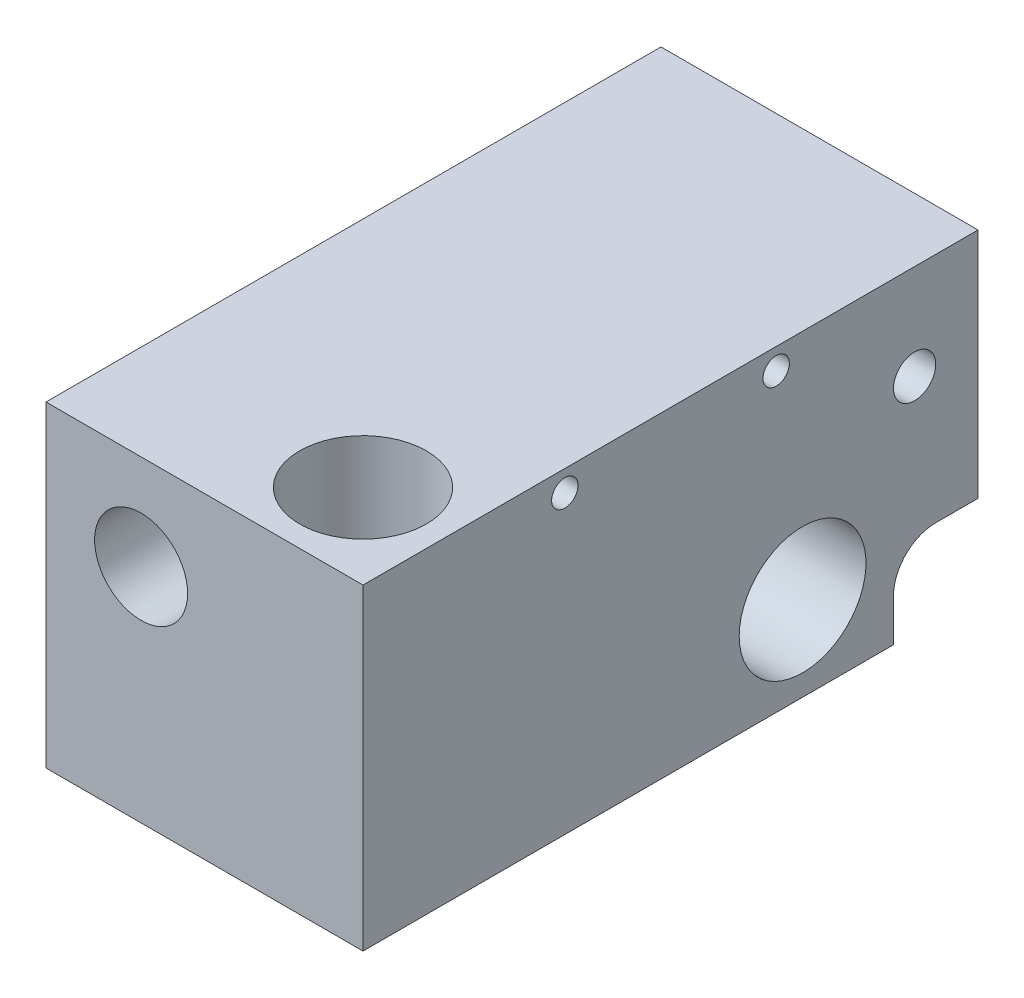
from build123d import *

# Parameters (mm, degrees)
SCHIZZO1_W                   = 30.00001
SCHIZZO1_H                   = 30.00001
ESTRUSIONE_ESTRUSIONE1_DEPTH = 58.2
TAGLIO_ESTRUSIONE1_REACH     = 74.023
SCHIZZO2_R                   = 6
TAGLIO_ESTRUSIONE2_REACH     = 74.023
SCHIZZO3_R                   = 6
SCHIZZO5_R                   = 7
TAGLIO_ESTRUSIONE3_DEPTH     = 20
FORO_6_0_6_1_D               = 6
FORO_FILETTATO_G1_8_1_D      = 8.8
FORO_FILETTATO_G1_8_1_DEPTH  = 10
FORO_FILETTATO_G1_8_1_TIP    = 2.643786724
FORO_FILETTATO_M3_1_REACH    = 74.023
FORO_FILETTATO_M3_1_BORE_R   = 1.25
FORO_4_0_4_2_D               = 4
FORO_4_0_4_2_DEPTH           = 8
FORO_4_0_4_2_TIP             = 1.201721238
TAGLIO_ESTRUSIONE5_DEPTH     = 10
TAGLIO_ESTRUSIONE6_START     = -10
TAGLIO_ESTRUSIONE6_DEPTH     = 10
SCHIZZO23_R                  = 1.6
TAGLIO_ESTRUSIONE7_DEPTH     = 10.00001
ESTRUSIONE_ESTRUSIONE2_START = 7
SCHIZZO24_R                  = 7
SCHIZZO24_R_2                = 3
ESTRUSIONE_ESTRUSIONE2_DEPTH = 7
FORO_FILETTATO_M3_2_D        = 2.5
FORO_FILETTATO_M3_2_DEPTH    = 11.5
FORO_FILETTATO_M3_2_TIP      = 0.751075774


with BuildPart() as part:
    # Schizzo1 → Estrusione-Estrusione1 (new body)
    with BuildSketch(Plane.XY):
        with Locations((15.000005, 15.000005)):
            Rectangle(SCHIZZO1_W, SCHIZZO1_H)
    extrude(amount=ESTRUSIONE_ESTRUSIONE1_DEPTH)

    # Schizzo2 → Taglio-Estrusione1 (cut, up to next)
    with BuildSketch(Plane.XZ, mode=Mode.PRIVATE) as taglio_estrusione1_sk1:
        with Locations(Location((22.00001, 50.2, 0), (0, 0, 270))):
            Circle(SCHIZZO2_R)
    taglio_estrusione1_tool1 = extrude(taglio_estrusione1_sk1.sketch, amount=-TAGLIO_ESTRUSIONE1_REACH, mode=Mode.PRIVATE) & part.part
    add(taglio_estrusione1_tool1.solids().sort_by_distance((22.00001, 0, 50.2))[0], mode=Mode.SUBTRACT)

    # Schizzo3 → Taglio-Estrusione2 (cut, up to next)
    with BuildSketch(Plane.ZY, mode=Mode.PRIVATE) as taglio_estrusione2_sk1:
        with Locations((16.6, 8)):
            Circle(SCHIZZO3_R)
    taglio_estrusione2_tool1 = extrude(taglio_estrusione2_sk1.sketch, amount=-TAGLIO_ESTRUSIONE2_REACH, mode=Mode.PRIVATE) & part.part
    add(taglio_estrusione2_tool1.solids().sort_by_distance((0, 8, 16.6))[0], mode=Mode.SUBTRACT)

    # Schizzo5 → Taglio-Estrusione3 (cut)
    with BuildSketch(Plane(origin=(0, 0, 0), x_dir=(-1, 0, 0), z_dir=(0, 0, -1))):
        with Locations((-9, 21.00001)):
            Circle(SCHIZZO5_R)
    extrude(amount=-TAGLIO_ESTRUSIONE3_DEPTH, mode=Mode.SUBTRACT)

    # Foro Ø6.0 (6)-1 (through all)
    with Locations(Plane.XY.offset(58.2)):
        with Locations((9, 21.00001)):
            Hole(FORO_6_0_6_1_D / 2)

    # Foro filettato G1/8-1
    with Locations(Plane(origin=(9, 21.00001, 58.2), x_dir=(1, 0, 0), z_dir=(0, 0, 1))):
        with Locations((0, 0)):
            Hole(FORO_FILETTATO_G1_8_1_D / 2, depth=FORO_FILETTATO_G1_8_1_DEPTH)
            with Locations((0, 0, -(FORO_FILETTATO_G1_8_1_DEPTH + FORO_FILETTATO_G1_8_1_TIP / 2))):  # 118° drill point
                Cone(0, FORO_FILETTATO_G1_8_1_D / 2, FORO_FILETTATO_G1_8_1_TIP, mode=Mode.SUBTRACT)

    # Foro filettato M3-1 bore → Foro filettato M3-1 (cut, up to next)
    with BuildSketch(Plane(origin=(30.00001, 0, 0), x_dir=(0, 0, -1), z_dir=(1, 0, 0)), mode=Mode.PRIVATE) as foro_filettato_m3_1_sk1:
        with Locations((-6, 21.00001)):
            Circle(FORO_FILETTATO_M3_1_BORE_R)
    foro_filettato_m3_1_tool1 = extrude(foro_filettato_m3_1_sk1.sketch, amount=-FORO_FILETTATO_M3_1_REACH, mode=Mode.PRIVATE) & part.part
    add(foro_filettato_m3_1_tool1.solids().sort_by_distance((30.00001, 21.00001, 6))[0], mode=Mode.SUBTRACT)

    # Foro Ø4.0 (4)-2
    with Locations(Plane(origin=(30.00001, 0, 0), x_dir=(0, 0, -1), z_dir=(1, 0, 0))):
        with Locations((-6, 21.00001)):
            Hole(FORO_4_0_4_2_D / 2, depth=FORO_4_0_4_2_DEPTH)
            with Locations((0, 0, -(FORO_4_0_4_2_DEPTH + FORO_4_0_4_2_TIP / 2))):  # 118° drill point
                Cone(0, FORO_4_0_4_2_D / 2, FORO_4_0_4_2_TIP, mode=Mode.SUBTRACT)

    # Schizzo20 → Taglio-Estrusione5 (cut)
    with BuildSketch(Plane.ZY):
        with BuildLine():
            Line((4, 8), (0, 8))
            Line((0, 8), (0, 0))
            Line((0, 0), (8, 0))
            Line((8, 0), (8, 4))
            ThreePointArc((8, 4), (6.828427125, 6.828427125), (4, 8))
        make_face()
    extrude(amount=-TAGLIO_ESTRUSIONE5_DEPTH, mode=Mode.SUBTRACT)

    # Schizzo21 → Taglio-Estrusione6 (cut)
    with BuildSketch(Plane(origin=(30.00001, 0, 0), x_dir=(0, 0, -1), z_dir=(1, 0, 0)).offset(TAGLIO_ESTRUSIONE6_START)):
        with BuildLine():
            Line((-8, 0), (-8, 4))
            ThreePointArc((-8, 4), (-6.828427125, 6.828427125), (-4, 8))
            Line((-4, 8), (0, 8))
            Line((0, 8), (0, 0))
            Line((0, 0), (-8, 0))
        make_face()
    extrude(amount=TAGLIO_ESTRUSIONE6_DEPTH, mode=Mode.SUBTRACT)

    # Schizzo23 → Taglio-Estrusione7 (cut)
    with BuildSketch(Plane.ZY.offset(-10)):
        with Locations((3.6, 3.6)):
            Circle(SCHIZZO23_R)
    extrude(amount=-TAGLIO_ESTRUSIONE7_DEPTH, mode=Mode.SUBTRACT)

    # Schizzo24 → Estrusione-Estrusione2 (add)
    with BuildSketch(Plane(origin=(0, 0, 20), x_dir=(-1, 0, 0), z_dir=(0, 0, -1)).offset(ESTRUSIONE_ESTRUSIONE2_START)):
        with Locations((-9, 21.00001)):
            Circle(SCHIZZO24_R)
        with Locations(Location((-9, 21.00001, 0), (0, 0, 180))):
            Circle(SCHIZZO24_R_2, mode=Mode.SUBTRACT)
    extrude(amount=-ESTRUSIONE_ESTRUSIONE2_DEPTH)

    # Foro filettato M3-2
    with Locations(Plane(origin=(30.00001, 28.00001, 39.1), x_dir=(0, 0, 1), z_dir=(1, 0, 0))):
        with Locations((0, 0), (-20, 0)):
            Hole(FORO_FILETTATO_M3_2_D / 2, depth=FORO_FILETTATO_M3_2_DEPTH)
            with Locations((0, 0, -(FORO_FILETTATO_M3_2_DEPTH + FORO_FILETTATO_M3_2_TIP / 2))):  # 118° drill point
                Cone(0, FORO_FILETTATO_M3_2_D / 2, FORO_FILETTATO_M3_2_TIP, mode=Mode.SUBTRACT)


solid = part.part
